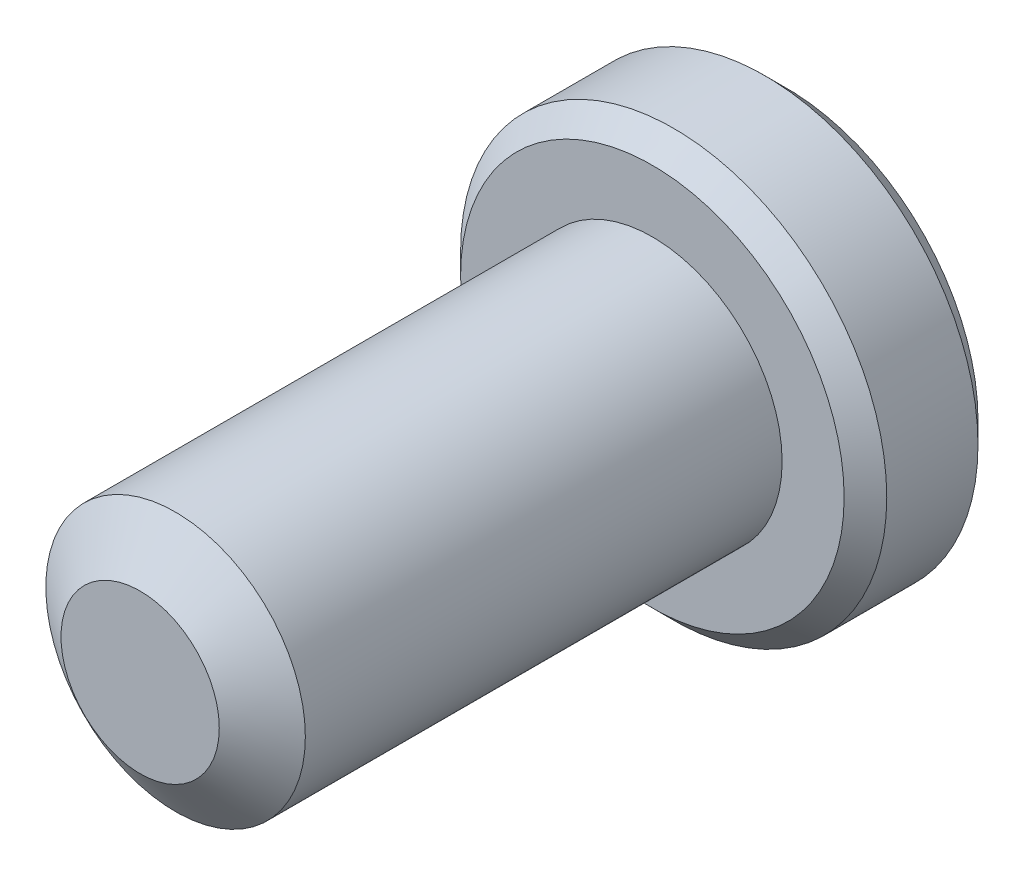
from build123d import *

# Parameters (mm, degrees)
SKETCH1_R          = 2.413
EXTRUDE1_DEPTH     = 9.525
SKETCH6_R          = 3.9624
EXTRUDE2_DEPTH     = 2.4892
CUT_EXTRUDE1_DEPTH = 1.7859375
CHAMFER1_SIZE      = 0.39624


with BuildPart() as part:
    # Sketch1 → Extrude1 (new body)
    with BuildSketch(Plane.XY):
        Circle(SKETCH1_R)
    extrude(amount=-EXTRUDE1_DEPTH)

    # Sketch4 → Cut-Revolve1 (revolve, cut)
    with BuildSketch(Plane(origin=(0, 0, 0), x_dir=(0, 0, -1), z_dir=(1, 0, 0))):
        Polygon((0.659180743, 2.413), (0, 1.471592336), (0, 2.413), align=None)
    revolve(axis=Axis((0, 0, 0), (0, 0, -1)), mode=Mode.SUBTRACT)

    # Sketch6 → Extrude2 (add)
    with BuildSketch(Plane(origin=(0, 0, -9.525), x_dir=(-1, 0, 0), z_dir=(0, 0, -1))):
        Circle(SKETCH6_R)
    extrude(amount=EXTRUDE2_DEPTH)

    # Sketch7 → Cut-Extrude1 (cut)
    with BuildSketch(Plane(origin=(0, 0, -12.0142), x_dir=(-1, 0, 0), z_dir=(0, 0, -1))):
        Polygon((0, 1.374815329), (-1.190625, 0.687407664), (-1.190625, -0.687407664), (0, -1.374815329), (1.190625, -0.687407664), (1.190625, 0.687407664), align=None)
    extrude(amount=-CUT_EXTRUDE1_DEPTH, mode=Mode.SUBTRACT)

    # Cut-Extrude2 cone 1 section (through the dimple's axis) → Cut-Extrude2 (revolve, cut)
    with BuildSketch(Plane(origin=(0, 0, -12.0142), x_dir=(0, 1, 0), z_dir=(1, 0, 0))):
        Polygon((0, 0), (1.374815329, 0), (0, 1.374815329), align=None)
    revolve(axis=Axis((0, 0, -12.0142), (0, 0, 1)), mode=Mode.SUBTRACT)

    # Chamfer1
    chamfer1_edges = [part.edges().sort_by_distance(p)[0] for p in [
        (3.9624, 0, -12.0142),
        (3.9624, 0, -9.525),
    ]]
    chamfer(chamfer1_edges, length=CHAMFER1_SIZE)


solid = part.part
